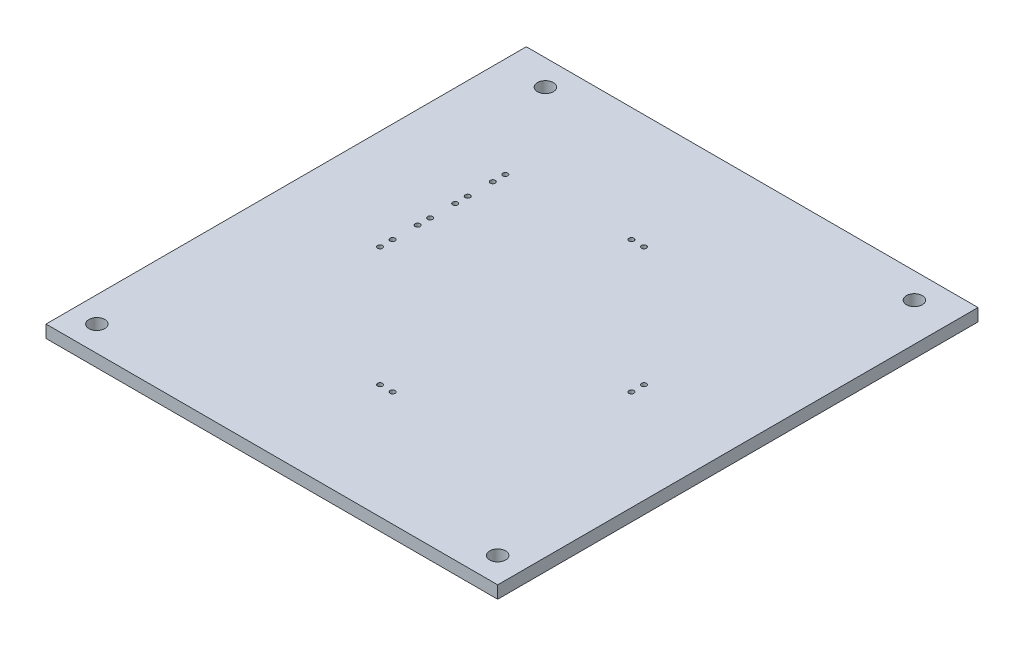
from build123d import *

# Parameters (mm, degrees)
SKETCH1_W           = 90.17
SKETCH1_H           = 95.885
BOSS_EXTRUDE1_DEPTH = 2.5
SKETCH2_R           = 1.5875
CUT_EXTRUDE1_DEPTH  = 2.5
SKETCH3_R           = 0.5
CUT_EXTRUDE2_DEPTH  = 10
CIRPATTERN1_COUNT   = 4
LPATTERN1_COUNT     = 4
LPATTERN1_PITCH     = 7.5


with BuildPart() as part:
    # Sketch1 → Boss-Extrude1 (new body)
    with BuildSketch(Plane(origin=(0, 0, 0), x_dir=(1, 0, 0), z_dir=(0, 1, 0))):
        Rectangle(SKETCH1_W, SKETCH1_H)
    extrude(amount=BOSS_EXTRUDE1_DEPTH)

    # Sketch2 → Cut-Extrude1 (cut)
    with BuildSketch(Plane(origin=(0, 2.5, 0), x_dir=(1, 0, 0), z_dir=(0, 1, 0))):
        with Locations((-40.005, -42.8625)):
            Circle(SKETCH2_R)
        with Locations((-36.195, 42.8625)):
            Circle(SKETCH2_R)
        with Locations((37.465, 42.8625)):
            Circle(SKETCH2_R)
        with Locations((40.005, -42.8625)):
            Circle(SKETCH2_R)
    extrude(amount=-CUT_EXTRUDE1_DEPTH, mode=Mode.SUBTRACT)

    # Sketch3 → Cut-Extrude2 (cut)
    with BuildSketch(Plane(origin=(0, 2.5, 0), x_dir=(1, 0, 0), z_dir=(0, 1, 0))):
        with Locations((-25.085, 1.25)):
            Circle(SKETCH3_R)
        with Locations((-25.085, -1.25)):
            Circle(SKETCH3_R)
    cut_extrude2 = extrude(amount=-CUT_EXTRUDE2_DEPTH, mode=Mode.SUBTRACT)

    # CirPattern1: Cut-Extrude2 ×4 about axis
    cirpattern1_axis = Axis((0, 50, 0), (0, -1, 0))
    for i in range(1, CIRPATTERN1_COUNT):
        add(cut_extrude2.rotate(cirpattern1_axis, i * 360 / CIRPATTERN1_COUNT), mode=Mode.SUBTRACT)

    # LPattern1: Cut-Extrude2 ×4
    with Locations(*[(0, 0, -i * LPATTERN1_PITCH) for i in range(1, LPATTERN1_COUNT)]):
        add(cut_extrude2, mode=Mode.SUBTRACT)


solid = part.part
